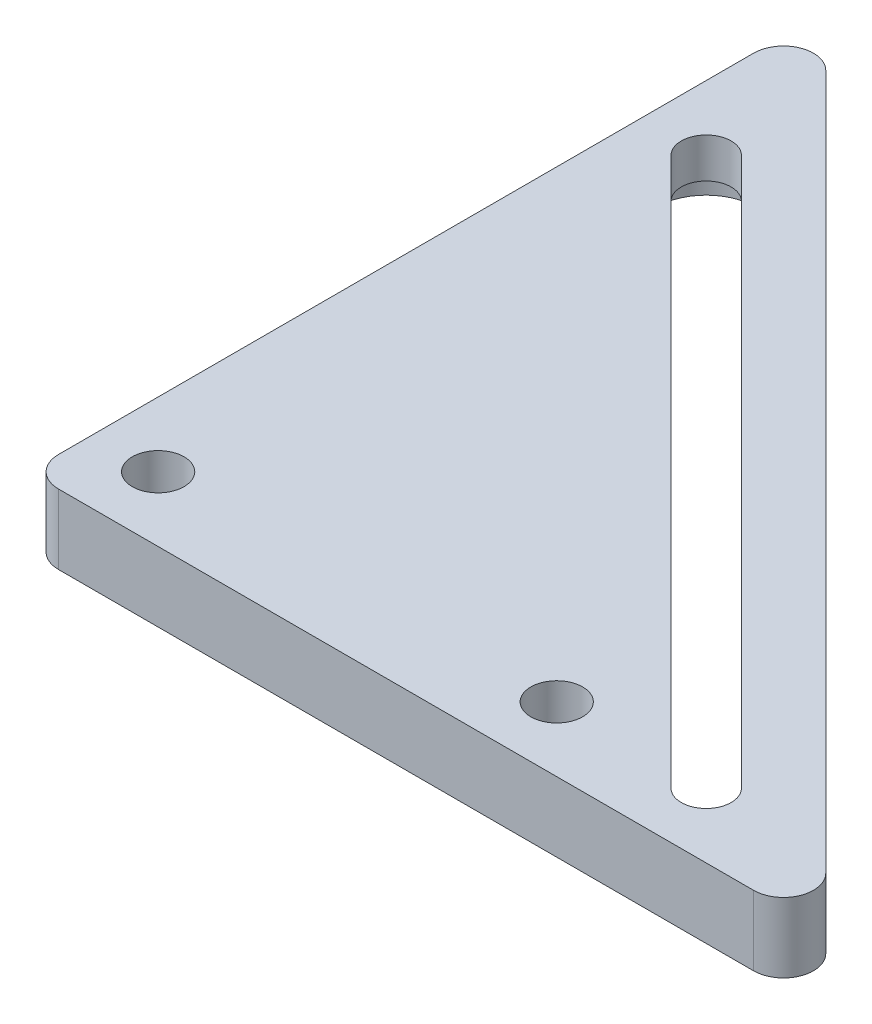
from build123d import *

# Parameters (mm, degrees)
EXTRUDE_1_DEPTH      = 10
SKETCH_5_R           = 2.6
CUT_EXTRUDE_3_DEPTH  = 10
FILLET_5_R           = 3
FILLET_6_R           = 3
FILLET_7_R           = 3
SKETCH_7_R           = 5.5
CUT_EXTRUDE_4_DEPTH  = 5
SKETCH_12_R          = 2.553682631
CUT_EXTRUDE_9_DEPTH  = 9
EXTRUDE_2_DEPTH      = 5
CUT_EXTRUDE_START    = 5
SKETCH_14_R          = 5.5
CUT_EXTRUDE_12_DEPTH = 5
EXTRUDE_START        = 5
EXTRUDE_6_DEPTH      = 5
SKETCH_22_R          = 5.5
EXTRUDE_7_DEPTH      = 5
SKETCH_24_R          = 5.5
CUT_EXTRUDE_14_DEPTH = 3
SKETCH_25_R          = 2.65
CUT_EXTRUDE_15_DEPTH = 3
SKETCH_26_R          = 2.65
CUT_EXTRUDE_16_DEPTH = 5
SKETCH_29_R          = 2.65
EXTRUDE_8_DEPTH      = 10
EXTRUDE_START_2      = 3
SKETCH_30_R          = 5.5
EXTRUDE_9_DEPTH      = 3
CUT_EXTRUDE_18_DEPTH = 3
SKETCH_33_R          = 5.5
SKETCH_33_R_2        = 2.6
EXTRUDE_10_DEPTH     = 5
SKETCH_34_W          = 118.655960463
SKETCH_34_H          = 108.474675719
CUT_EXTRUDE_20_DEPTH = 3
CUT_EXTRUDE_21_DEPTH = 108.211729676


with BuildPart() as part:
    # 草图1 → 凸台-拉伸1 (new body)
    with BuildSketch(Plane(origin=(0, 0, 0), x_dir=(1, 0, 0), z_dir=(0, 1, 0))):
        Polygon((0, 0), (0, 80), (80, 0), align=None)
    extrude(amount=EXTRUDE_1_DEPTH)

    # 草图5 → 切除-拉伸3 (cut)
    with BuildSketch(Plane(origin=(0, 10, 0), x_dir=(1, 0, 0), z_dir=(0, 1, 0))):
        with Locations(Location((6.5, 6.5, 0), (0, 0, 270))):
            Circle(SKETCH_5_R)
        with Locations(Location((6.5, 46.5, 0), (0, 0, 270))):
            Circle(SKETCH_5_R)
        with Locations(Location((46.5, 6.5, 0), (0, 0, 270))):
            Circle(SKETCH_5_R)
    extrude(amount=-CUT_EXTRUDE_3_DEPTH, mode=Mode.SUBTRACT)

    # 圆角5
    fillet_5_edges = [part.edges().sort_by_distance(p)[0] for p in [
        (80, 5, 0),
    ]]
    fillet(fillet_5_edges, radius=FILLET_5_R)

    # 圆角6
    fillet_6_edges = [part.edges().sort_by_distance(p)[0] for p in [
        (0, 5, -80),
    ]]
    fillet(fillet_6_edges, radius=FILLET_6_R)

    # 圆角7
    fillet_7_edges = [part.edges().sort_by_distance(p)[0] for p in [
        (0, 5, 0),
    ]]
    fillet(fillet_7_edges, radius=FILLET_7_R)

    # 草图7 → 切除-拉伸4 (cut)
    with BuildSketch(Plane(origin=(0, 10, 0), x_dir=(1, 0, 0), z_dir=(0, 1, 0))):
        with Locations(Location((6.5, 6.5, 0), (0, 0, 270))):
            Circle(SKETCH_7_R)
        with Locations(Location((6.5, 46.5, 0), (0, 0, 270))):
            Circle(SKETCH_7_R)
        with Locations(Location((46.5, 6.5, 0), (0, 0, 270))):
            Circle(SKETCH_7_R)
    extrude(amount=-CUT_EXTRUDE_4_DEPTH, mode=Mode.SUBTRACT)

    # 草图12 → 切除-拉伸9 (cut)
    with BuildSketch(Plane.XZ):
        with Locations((8.5, -46.5)):
            Circle(SKETCH_12_R)
    extrude(amount=-CUT_EXTRUDE_9_DEPTH, mode=Mode.SUBTRACT)

    # 草图13 → 凸台-拉伸2 (add)
    with BuildSketch(Plane.XZ):
        with BuildLine():
            ThreePointArc((7.559676255, -48.87425488), (5.946317369, -46.5), (7.559676255, -44.12574512))
            ThreePointArc((7.559676255, -44.12574512), (3.9, -46.5), (7.559676255, -48.87425488))
        make_face()
    extrude(amount=-EXTRUDE_2_DEPTH)

    # 草图14 → 切除-拉伸12 (cut)
    with BuildSketch(Plane(origin=(0, 5, 0), x_dir=(1, 0, 0), z_dir=(0, 1, 0)).offset(CUT_EXTRUDE_START)):
        with Locations((8.5, 46.5)):
            Circle(SKETCH_14_R)
        with Locations((6.5, 46.5)):
            Circle(SKETCH_14_R)
    extrude(amount=-CUT_EXTRUDE_12_DEPTH, mode=Mode.SUBTRACT)

    # 草图21 → 凸台-拉伸6 (add)
    with BuildSketch(Plane(origin=(0, 5, 0), x_dir=(1, 0, 0), z_dir=(0, 1, 0)).offset(EXTRUDE_START)):
        with BuildLine():
            ThreePointArc((7.5, 41.091673087), (3, 46.5), (7.5, 51.908326913))
            ThreePointArc((7.5, 51.908326913), (1, 46.5), (7.5, 41.091673087))
        make_face()
    extrude(amount=-EXTRUDE_6_DEPTH)

    # 草图22 → 凸台-拉伸7 (add)
    with BuildSketch(Plane(origin=(0, 5, 0), x_dir=(1, 0, 0), z_dir=(0, 1, 0)).offset(EXTRUDE_START)):
        with Locations((8.5, 46.5)):
            Circle(SKETCH_22_R)
    extrude(amount=-EXTRUDE_7_DEPTH)

    # 草图24 → 切除-拉伸14 (cut)
    with BuildSketch(Plane(origin=(0, 10, 0), x_dir=(1, 0, 0), z_dir=(0, 1, 0))):
        with Locations(Location((8.5, 46.5, 0), (0, 0, 270))):
            Circle(SKETCH_24_R)
    extrude(amount=-CUT_EXTRUDE_14_DEPTH, mode=Mode.SUBTRACT)

    # 草图25 → 切除-拉伸15 (cut)
    with BuildSketch(Plane.XZ.offset(-5)):
        with Locations(Location((8.5, -46.5, 0), (0, 0, 270))):
            Circle(SKETCH_25_R)
    extrude(amount=-CUT_EXTRUDE_15_DEPTH, mode=Mode.SUBTRACT)

    # 草图26 → 切除-拉伸16 (cut)
    with BuildSketch(Plane.XZ):
        with Locations(Location((8.5, -46.5, 0), (0, 0, 270))):
            Circle(SKETCH_26_R)
    extrude(amount=-CUT_EXTRUDE_16_DEPTH, mode=Mode.SUBTRACT)

    # 草图29 → 凸台-拉伸8 (add)
    with BuildSketch(Plane.XZ):
        with Locations(Location((8.5, -46.5, 0), (0, 0, 270))):
            Circle(SKETCH_29_R)
    extrude(amount=-EXTRUDE_8_DEPTH)

    # 草图30 → 凸台-拉伸9 (add)
    with BuildSketch(Plane(origin=(0, 7, 0), x_dir=(1, 0, 0), z_dir=(0, 1, 0)).offset(EXTRUDE_START_2)):
        with Locations((8.5, 46.5)):
            Circle(SKETCH_30_R)
    extrude(amount=-EXTRUDE_9_DEPTH)

    # 草图2 → 切除-拉伸18 (cut)
    with BuildSketch(Plane.XZ):
        with BuildLine():
            ThreePointArc((6.5, -56.5), (8.413417162, -56.880602337), (10.035533906, -57.964466094))
            Line((10.035533906, -57.964466094), (57.964466094, -10.035533906))
            ThreePointArc((57.964466094, -10.035533906), (56.880602337, -8.413417162), (56.5, -6.5))
            Line((56.5, -6.5), (54.428932188, -6.5))
            Line((54.428932188, -6.5), (6.5, -54.428932188))
            Line((6.5, -54.428932188), (6.5, -56.5))
        make_face()
        with BuildLine():
            Line((57.964466094, -10.035533906), (10.035533906, -57.964466094))
            ThreePointArc((10.035533906, -57.964466094), (11.119397663, -59.586582838), (11.5, -61.5))
            ThreePointArc((11.5, -61.5), (11.119397663, -63.413417162), (10.035533906, -65.035533906))
            Line((10.035533906, -65.035533906), (65.035533906, -10.035533906))
            ThreePointArc((65.035533906, -10.035533906), (61.5, -11.5), (57.964466094, -10.035533906))
        make_face()
        with BuildLine():
            Line((6.5, -66.5), (6.5, -61.5))
            Line((6.5, -61.5), (6.5, -56.5))
            ThreePointArc((6.5, -56.5), (4.586582838, -56.880602337), (2.964466094, -57.964466094))
            ThreePointArc((2.964466094, -57.964466094), (1.880602337, -63.413417162), (6.5, -66.5))
        make_face()
        with BuildLine():
            Line((6.5, -56.5), (6.5, -61.5))
            Line((6.5, -61.5), (10.035533906, -57.964466094))
            ThreePointArc((10.035533906, -57.964466094), (8.413417162, -56.880602337), (6.5, -56.5))
        make_face()
        with BuildLine():
            Line((10.035533906, -57.964466094), (6.5, -61.5))
            Line((6.5, -61.5), (6.5, -66.5))
            ThreePointArc((6.5, -66.5), (8.413417162, -66.119397663), (10.035533906, -65.035533906))
            ThreePointArc((10.035533906, -65.035533906), (11.119397663, -63.413417162), (11.5, -61.5))
            ThreePointArc((11.5, -61.5), (11.119397663, -59.586582838), (10.035533906, -57.964466094))
        make_face()
        with BuildLine():
            Line((6.5, -56.5), (6.5, -61.5))
            Line((6.5, -61.5), (10.035533906, -57.964466094))
            ThreePointArc((10.035533906, -57.964466094), (8.413417162, -56.880602337), (6.5, -56.5))
        make_face()
        with BuildLine():
            Line((10.035533906, -57.964466094), (6.5, -61.5))
            Line((6.5, -61.5), (6.5, -66.5))
            ThreePointArc((6.5, -66.5), (8.413417162, -66.119397663), (10.035533906, -65.035533906))
            ThreePointArc((10.035533906, -65.035533906), (11.119397663, -63.413417162), (11.5, -61.5))
            ThreePointArc((11.5, -61.5), (11.119397663, -59.586582838), (10.035533906, -57.964466094))
        make_face()
        with BuildLine():
            ThreePointArc((2.964466094, -57.964466094), (4.586582838, -56.880602337), (6.5, -56.5))
            Line((6.5, -56.5), (6.5, -54.428932188))
            Line((6.5, -54.428932188), (2.964466094, -57.964466094))
        make_face()
        with BuildLine():
            Line((54.428932188, -6.5), (56.5, -6.5))
            ThreePointArc((56.5, -6.5), (56.880602337, -4.586582838), (57.964466094, -2.964466094))
            Line((57.964466094, -2.964466094), (54.428932188, -6.5))
        make_face()
        with BuildLine():
            Line((56.5, -6.5), (61.5, -6.5))
            Line((61.5, -6.5), (66.5, -6.5))
            ThreePointArc((66.5, -6.5), (63.413417162, -1.880602337), (57.964466094, -2.964466094))
            ThreePointArc((57.964466094, -2.964466094), (56.880602337, -4.586582838), (56.5, -6.5))
        make_face()
        with BuildLine():
            ThreePointArc((56.5, -6.5), (56.880602337, -8.413417162), (57.964466094, -10.035533906))
            Line((57.964466094, -10.035533906), (61.5, -6.5))
            Line((61.5, -6.5), (56.5, -6.5))
        make_face()
        with BuildLine():
            Line((61.5, -6.5), (57.964466094, -10.035533906))
            ThreePointArc((57.964466094, -10.035533906), (61.5, -11.5), (65.035533906, -10.035533906))
            ThreePointArc((65.035533906, -10.035533906), (66.119397663, -8.413417162), (66.5, -6.5))
            Line((66.5, -6.5), (61.5, -6.5))
        make_face()
        with BuildLine():
            ThreePointArc((56.5, -6.5), (56.880602337, -8.413417162), (57.964466094, -10.035533906))
            Line((57.964466094, -10.035533906), (61.5, -6.5))
            Line((61.5, -6.5), (56.5, -6.5))
        make_face()
        with BuildLine():
            Line((61.5, -6.5), (57.964466094, -10.035533906))
            ThreePointArc((57.964466094, -10.035533906), (61.5, -11.5), (65.035533906, -10.035533906))
            ThreePointArc((65.035533906, -10.035533906), (66.119397663, -8.413417162), (66.5, -6.5))
            Line((66.5, -6.5), (61.5, -6.5))
        make_face()
    extrude(amount=-CUT_EXTRUDE_18_DEPTH, mode=Mode.SUBTRACT)

    # 草图33 → 凸台-拉伸10 (add)
    # profile 1 of 2: a face of its own
    with BuildSketch(Plane(origin=(0, 10, 0), x_dir=(1, 0, 0), z_dir=(0, 1, 0))):
        with Locations((6.5, 6.5)):
            Circle(SKETCH_33_R)
        with Locations(Location((6.5, 6.5, 0), (0, 0, 270))):
            Circle(SKETCH_33_R_2, mode=Mode.SUBTRACT)
    # profile 2 of 2: a face of its own
    with BuildSketch(Plane(origin=(0, 10, 0), x_dir=(1, 0, 0), z_dir=(0, 1, 0))):
        with Locations((46.5, 6.5)):
            Circle(SKETCH_33_R)
        with Locations(Location((46.5, 6.5, 0), (0, 0, 270))):
            Circle(SKETCH_33_R_2, mode=Mode.SUBTRACT)
    extrude(amount=-EXTRUDE_10_DEPTH)

    # 草图34 → 切除-拉伸20 (cut)
    with BuildSketch(Plane(origin=(0, 10, 0), x_dir=(1, 0, 0), z_dir=(0, 1, 0))):
        with Locations((37.4387476, 33.290816779)):
            Rectangle(SKETCH_34_W, SKETCH_34_H)
    extrude(amount=-CUT_EXTRUDE_20_DEPTH, mode=Mode.SUBTRACT)

    # 草图35 → 切除-拉伸21 (cut, through all)
    with BuildSketch(Plane.XZ.offset(-3)):
        with BuildLine():
            Line((8.267766953, -63.267766953), (63.267766953, -8.267766953))
            ThreePointArc((63.267766953, -8.267766953), (63.267766953, -4.732233047), (59.732233047, -4.732233047))
            Line((59.732233047, -4.732233047), (4.732233047, -59.732233047))
            ThreePointArc((4.732233047, -59.732233047), (4.732233047, -63.267766953), (8.267766953, -63.267766953))
        make_face()
    extrude(amount=-CUT_EXTRUDE_21_DEPTH, mode=Mode.SUBTRACT)


solid = part.part
